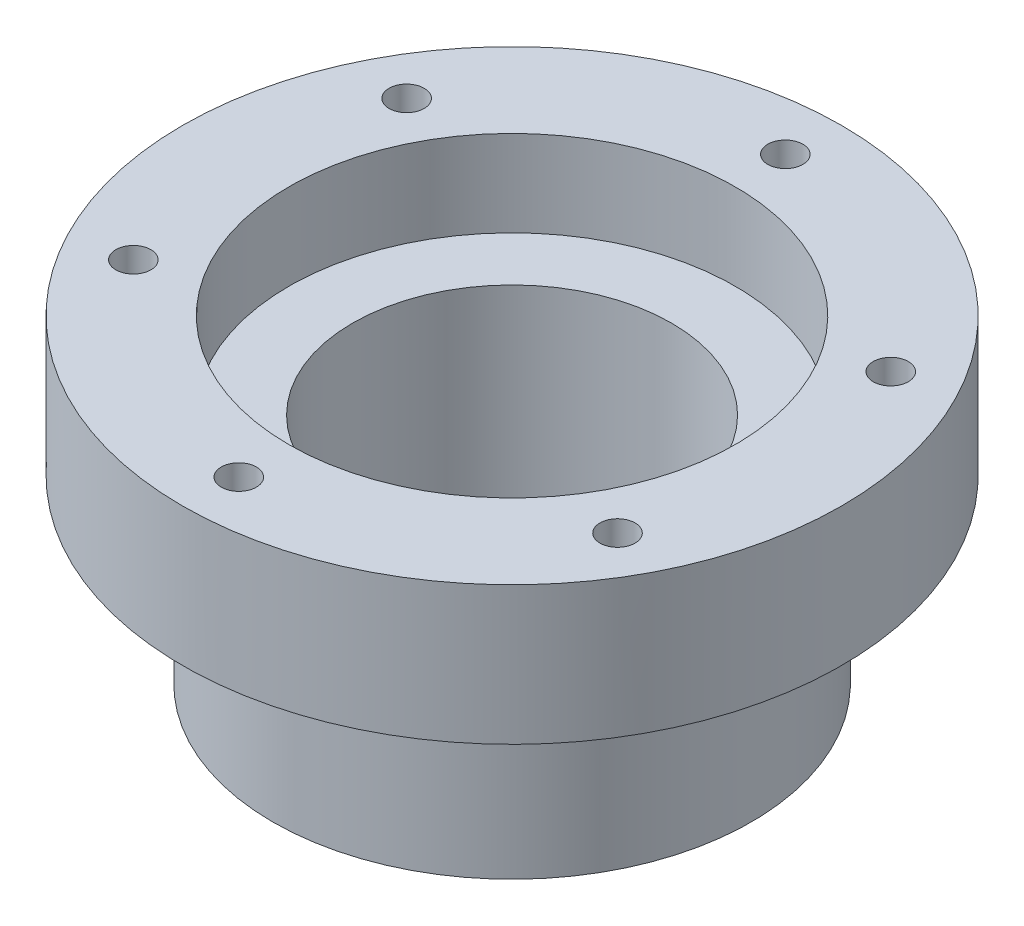
from build123d import *

# Parameters (mm, degrees)
ESBO_O1_R                = 31
RESSALTO_EXTRUS_O1_DEPTH = 30
ESBO_O2_R                = 31
ESBO_O2_R_2              = 22.5
CORTE_EXTRUS_O1_DEPTH    = 17
ESBO_O2_3_R              = 15
CORTE_EXTRUS_O2_DEPTH    = 54.122499941
ESBO_O4_R                = 21
CORTE_EXTRUS_O3_DEPTH    = 8.1
FURO_ROSCADO_DE_M41_D    = 3.3
FILETE1_R                = 1


with BuildPart() as part:
    # Esboço1 → Ressalto-extrusão1 (new body)
    with BuildSketch(Plane(origin=(0, 0, 0), x_dir=(1, 0, 0), z_dir=(0, 1, 0))):
        Circle(ESBO_O1_R)
    extrude(amount=RESSALTO_EXTRUS_O1_DEPTH)

    # Esboço2 → Corte-extrusão1 (cut)
    with BuildSketch(Plane.XZ):
        Circle(ESBO_O2_R)
        Circle(ESBO_O2_R_2, mode=Mode.SUBTRACT)
    extrude(amount=-CORTE_EXTRUS_O1_DEPTH, mode=Mode.SUBTRACT)

    # Esboço2<3> → Corte-extrusão2 (cut, through all)
    with BuildSketch(Plane.XZ):
        Circle(ESBO_O2_3_R)
    extrude(amount=-CORTE_EXTRUS_O2_DEPTH, mode=Mode.SUBTRACT)

    # Esboço4 → Corte-extrusão3 (cut)
    with BuildSketch(Plane(origin=(0, 30, 0), x_dir=(1, 0, 0), z_dir=(0, 1, 0))):
        Circle(ESBO_O4_R)
    extrude(amount=-CORTE_EXTRUS_O3_DEPTH, mode=Mode.SUBTRACT)

    # Furo roscado de M41 (through all)
    with Locations(Plane(origin=(0, 30, 0), x_dir=(1, 0, 0), z_dir=(0, 1, 0))):
        with Locations((-0.294790254, 25.998328768), (22.367818042, 13.254460232), (22.662608295, -12.743868535), (0.294790254, -25.998328768), (-22.367818042, -13.254460232), (-22.662608295, 12.743868535)):
            Hole(FURO_ROSCADO_DE_M41_D / 2)

    # Filete1
    filete1_edges = [part.edges().sort_by_distance(p)[0] for p in [
        (-22.5, 17, 0),
    ]]
    fillet(filete1_edges, radius=FILETE1_R)


solid = part.part
